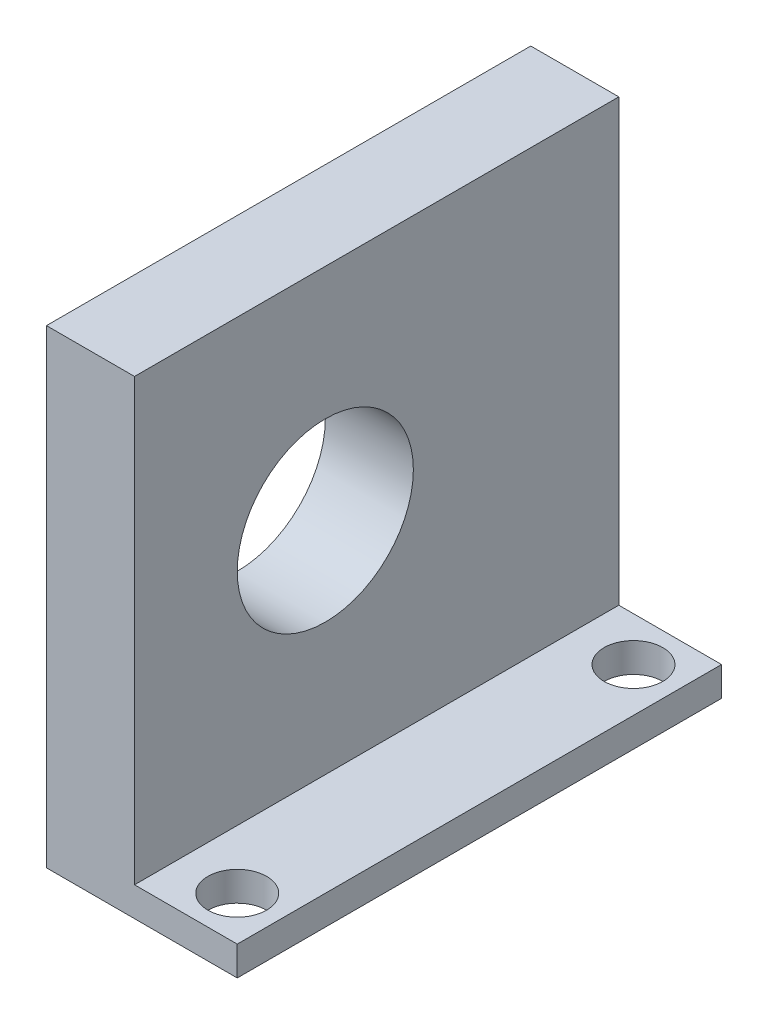
from build123d import *

# Parameters (mm, degrees)
BOSS_EXTRUDE1_DEPTH = 33
CUT_EXTRUDE1_REACH  = 48.497
SKETCH2_R           = 6
CUT_EXTRUDE2_REACH  = 48.454
SKETCH3_R           = 2


with BuildPart() as part:
    # Sketch1 → Boss-Extrude1 (new body)
    with BuildSketch(Plane.XY):
        Polygon((0, 0), (0, 32), (6, 32), (6, 2), (13, 2), (13, 0), align=None)
    extrude(amount=BOSS_EXTRUDE1_DEPTH)

    # Sketch2 → Cut-Extrude1 (cut, up to next)
    with BuildSketch(Plane(origin=(6, 0, 0), x_dir=(0, 0, -1), z_dir=(1, 0, 0)), mode=Mode.PRIVATE) as cut_extrude1_sk1:
        with Locations(Location((-20, 17, 0), (0, 0, 90))):
            Circle(SKETCH2_R)
    cut_extrude1_tool1 = extrude(cut_extrude1_sk1.sketch, amount=-CUT_EXTRUDE1_REACH, mode=Mode.PRIVATE) & part.part
    add(cut_extrude1_tool1.solids().sort_by_distance((6, 17, 20))[0], mode=Mode.SUBTRACT)

    # Sketch3 → Cut-Extrude2 (cut, up to next)
    with BuildSketch(Plane(origin=(0, 2, 0), x_dir=(1, 0, 0), z_dir=(0, 1, 0)), mode=Mode.PRIVATE) as cut_extrude2_sk1:
        with Locations(Location((10, -3, 0), (0, 0, 180))):
            Circle(SKETCH3_R)
    cut_extrude2_tool1 = extrude(cut_extrude2_sk1.sketch, amount=-CUT_EXTRUDE2_REACH, mode=Mode.PRIVATE) & part.part
    # Sketch3 → Cut-Extrude2 (cut, up to next)
    with BuildSketch(Plane(origin=(0, 2, 0), x_dir=(1, 0, 0), z_dir=(0, 1, 0)), mode=Mode.PRIVATE) as cut_extrude2_sk2:
        with Locations(Location((10, -30, 0), (0, 0, 180))):
            Circle(SKETCH3_R)
    cut_extrude2_tool2 = extrude(cut_extrude2_sk2.sketch, amount=-CUT_EXTRUDE2_REACH, mode=Mode.PRIVATE) & part.part
    add(cut_extrude2_tool1.solids().sort_by_distance((10, 2, 3))[0], mode=Mode.SUBTRACT)
    add(cut_extrude2_tool2.solids().sort_by_distance((10, 2, 30))[0], mode=Mode.SUBTRACT)


solid = part.part
